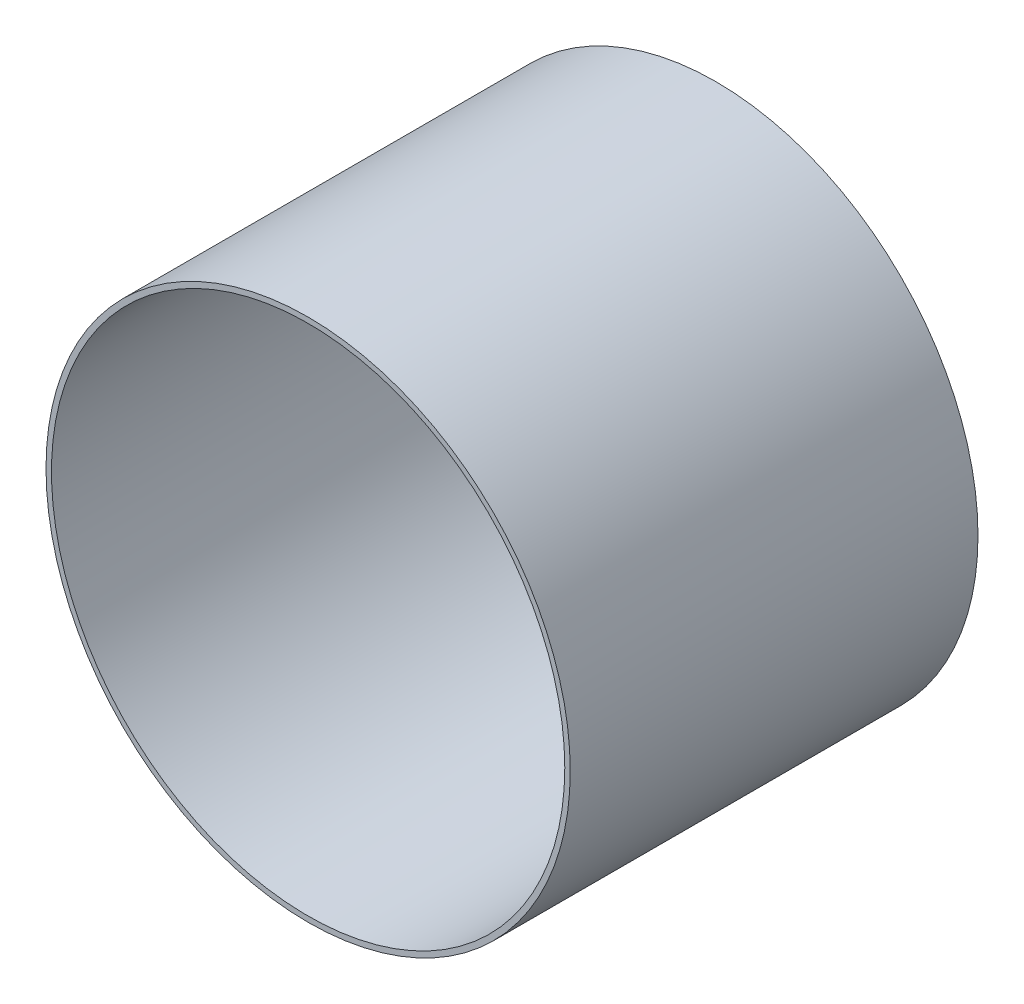
from build123d import *

# Parameters (mm, degrees)
SKETCH4_R           = 36
SKETCH4_R_2         = 35.25
BOSS_EXTRUDE2_DEPTH = 56


with BuildPart() as part:
    # Sketch4 → Boss-Extrude2 (new body)
    with BuildSketch(Plane(origin=(0, 0, 0), x_dir=(-1, 0, 0), z_dir=(0, 0, 1))):
        with Locations(Location((-49.972170182, -129.231293468, 0), (0, 0, 180))):
            Circle(SKETCH4_R)
        with Locations(Location((-49.972170182, -129.231293468, 0), (0, 0, 180))):
            Circle(SKETCH4_R_2, mode=Mode.SUBTRACT)
    extrude(amount=BOSS_EXTRUDE2_DEPTH)


solid = part.part
